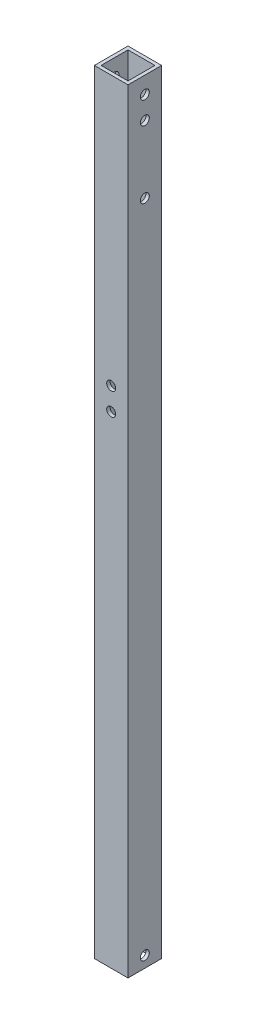
from build123d import *

# Parameters (mm, degrees)
SKETCH_1_W          = 15
SKETCH_1_H          = 15
SKETCH_1_W_2        = 12
SKETCH_1_H_2        = 12
EXTRUDE_1_DEPTH     = 345
SKETCH_2_R          = 2
CUT_EXTRUDE_1_DEPTH = 346.40736819
SKETCH_3_R          = 2
CUT_EXTRUDE_2_DEPTH = 346.40736819


with BuildPart() as part:
    # ｽｹｯﾁ1 → 押し出し-薄板1 (new body)
    with BuildSketch(Plane(origin=(0, 0, 0), x_dir=(1, 0, 0), z_dir=(0, 1, 0))):
        Rectangle(SKETCH_1_W, SKETCH_1_H)
        Rectangle(SKETCH_1_W_2, SKETCH_1_H_2, mode=Mode.SUBTRACT)
    extrude(amount=EXTRUDE_1_DEPTH)

    # ｽｹｯﾁ2 → ｶｯﾄ - 押し出し1 (cut, through all)
    with BuildSketch(Plane(origin=(7.5, 0, 0), x_dir=(0, 0, -1), z_dir=(1, 0, 0))):
        with Locations((0, 5)):
            Circle(SKETCH_2_R)
        with Locations((0, 297.5)):
            Circle(SKETCH_2_R)
        with Locations((0, 337.5)):
            Circle(SKETCH_2_R)
        with Locations((0, 327.5)):
            Circle(SKETCH_2_R)
    extrude(amount=-CUT_EXTRUDE_1_DEPTH, mode=Mode.SUBTRACT)

    # ｽｹｯﾁ3 → ｶｯﾄ - 押し出し2 (cut, through all)
    with BuildSketch(Plane.XY.offset(7.5)):
        with Locations((0, 225)):
            Circle(SKETCH_3_R)
        with Locations((0, 215)):
            Circle(SKETCH_3_R)
    extrude(amount=-CUT_EXTRUDE_2_DEPTH, mode=Mode.SUBTRACT)


solid = part.part
